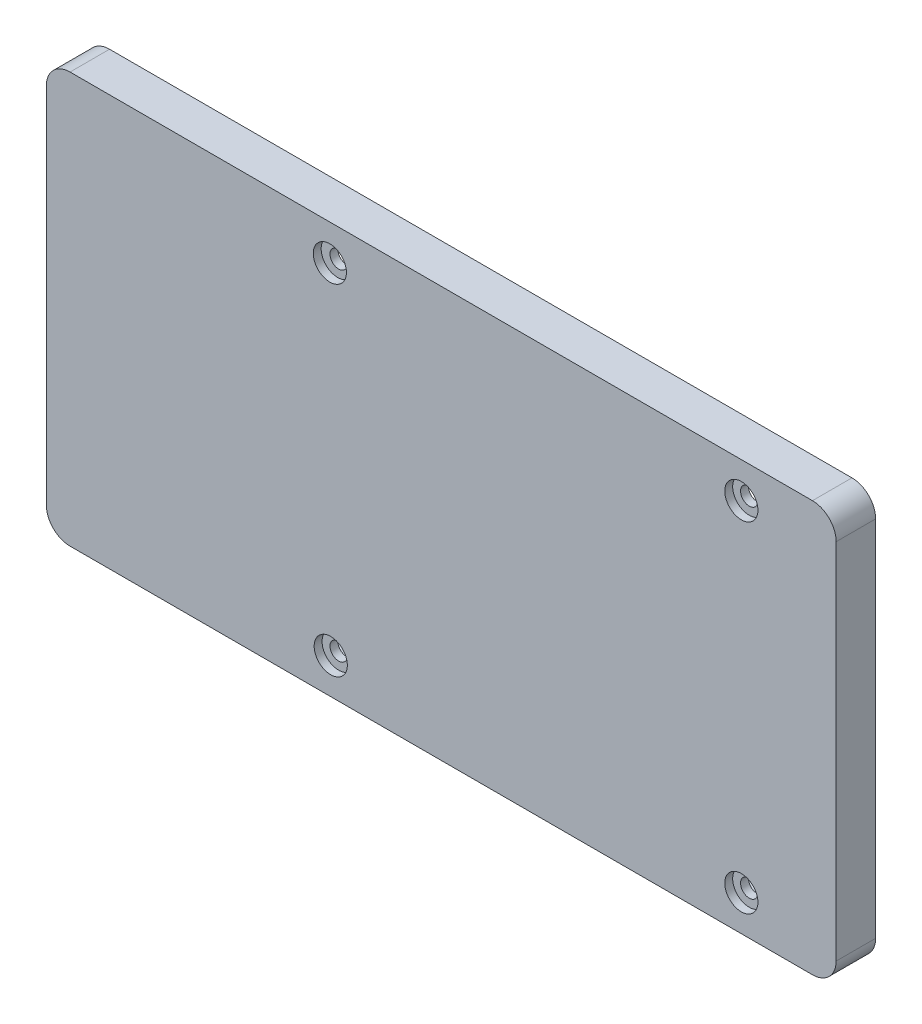
from build123d import *

# Parameters (mm, degrees)
SKETCH_1_W          = 99.97480061
SKETCH_1_H          = 51.97470409
EXTRUDE_1_DEPTH     = 5
SKETCH_2_W          = 96.97480061
SKETCH_2_H          = 48.730863602
CUT_EXTRUDE_1_DEPTH = 3
SKETCH_3_R          = 1.1
CUT_EXTRUDE_2_DEPTH = 1437.467063218
FILLET_1_R          = 3
FILLET_2_R          = 2
SKETCH_4_R          = 2.1
CUT_EXTRUDE_3_DEPTH = 1


with BuildPart() as part:
    # 草图1 → 凸台-拉伸1 (new body)
    with BuildSketch(Plane.XY.offset(1066.885602923)):
        with Locations((934.401162421, 1020.144466268)):
            Rectangle(SKETCH_1_W, SKETCH_1_H)
    extrude(amount=EXTRUDE_1_DEPTH)

    # 草图2 → 切除-拉伸1 (cut)
    with BuildSketch(Plane(origin=(0, 0, 1066.885602923), x_dir=(-1, 0, 0), z_dir=(0, 0, -1))):
        with Locations((-934.401162421, 1020.022546024)):
            Rectangle(SKETCH_2_W, SKETCH_2_H)
    extrude(amount=-CUT_EXTRUDE_1_DEPTH, mode=Mode.SUBTRACT)

    # 草图3 → 切除-拉伸2 (cut, through all)
    with BuildSketch(Plane.XY.offset(1071.885602923)):
        with Locations((972.388562726, 1041.631818313)):
            Circle(SKETCH_3_R)
        with Locations((972.388562726, 998.657114223)):
            Circle(SKETCH_3_R)
        with Locations((920.413762116, 998.657114223)):
            Circle(SKETCH_3_R)
        with Locations((920.413762116, 1041.631818313)):
            Circle(SKETCH_3_R)
    extrude(amount=-CUT_EXTRUDE_2_DEPTH, mode=Mode.SUBTRACT)

    # 圆角1
    fillet_1_edges = [part.edges().sort_by_distance(p)[0] for p in [
        (884.413762116, 1046.131818313, 1069.385602923),
        (984.388562726, 1046.131818313, 1069.385602923),
        (984.388562726, 994.157114223, 1069.385602923),
        (884.413762116, 994.157114223, 1069.385602923),
    ]]
    fillet(fillet_1_edges, radius=FILLET_1_R)

    # 圆角2
    fillet_2_edges = [part.edges().sort_by_distance(p)[0] for p in [
        (982.888562726, 995.657114223, 1068.385602923),
        (982.888562726, 1044.387977825, 1068.385602923),
        (885.913762116, 1044.387977825, 1068.385602923),
        (885.913762116, 995.657114223, 1068.385602923),
    ]]
    fillet(fillet_2_edges, radius=FILLET_2_R)

    # 草图4 → 切除-拉伸3 (cut)
    with BuildSketch(Plane.XY.offset(1071.885602923)):
        with Locations((920.299535548, 1041.644508178)):
            Circle(SKETCH_4_R)
        with Locations((972.388562726, 1041.631818313)):
            Circle(SKETCH_4_R)
        with Locations((972.388562726, 998.657114223)):
            Circle(SKETCH_4_R)
        with Locations((920.413762116, 998.657114223)):
            Circle(SKETCH_4_R)
    extrude(amount=-CUT_EXTRUDE_3_DEPTH, mode=Mode.SUBTRACT)


solid = part.part
